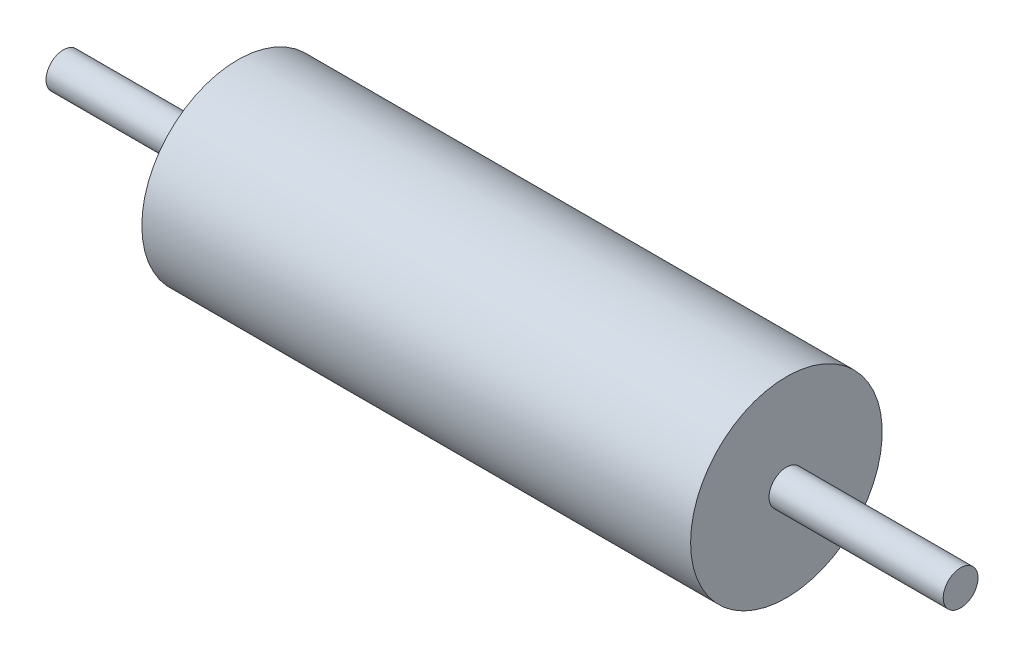
from build123d import *


with BuildPart() as part:
    # Эскиз1 → Повернуть1 (revolve)
    with BuildSketch(Plane(origin=(0, 0, 0), x_dir=(1, 0, 0), z_dir=(0, 1, 0)), mode=Mode.PRIVATE) as revolve_1_sk:
        Polygon((0, 0), (-6.3, 0), (-8.3, 0), (-8.3, 0.2), (-6.3, 0.2), (-6.3, 1.1), (0, 1.1), (0, 0.2), (2, 0.2), (2, 0), align=None)
    revolve(revolve_1_sk.sketch.rotate(Axis((0, 0, 0), (1, 0, 0)), 180), axis=Axis((0, 0, 0), (1, 0, 0)))


solid = part.part
